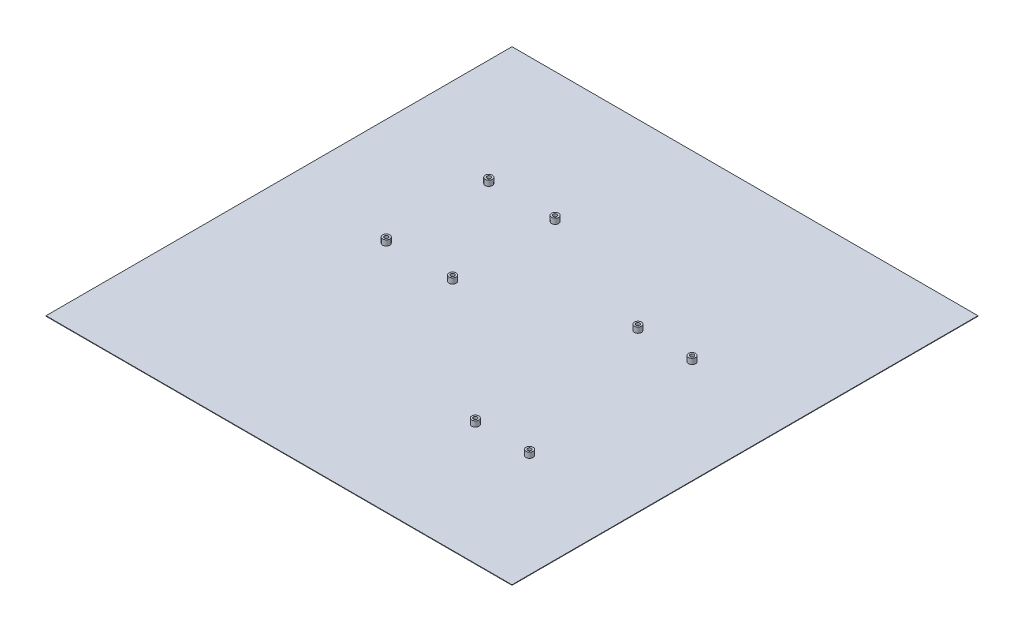
from build123d import *

# Parameters (mm, degrees)
SKETCH1_W           = 430
SKETCH1_H           = 430
BOSS_EXTRUDE1_DEPTH = 0.45
SKETCH7_R           = 3.3
BOSS_EXTRUDE2_DEPTH = 5
SKETCH8_R           = 1.75
CUT_EXTRUDE1_DEPTH  = 4
SKETCH6_R           = 3.3
BOSS_EXTRUDE3_DEPTH = 5
SKETCH10_R          = 1.75
CUT_EXTRUDE2_DEPTH  = 4


with BuildPart() as part:
    # Sketch1 → Boss-Extrude1 (new body)
    with BuildSketch(Plane(origin=(0, 0, 0), x_dir=(1, 0, 0), z_dir=(0, 1, 0))):
        Rectangle(SKETCH1_W, SKETCH1_H)
    extrude(amount=BOSS_EXTRUDE1_DEPTH)

    # Sketch7 → Boss-Extrude2 (add)
    with BuildSketch(Plane(origin=(0, 0.45, 0), x_dir=(1, 0, 0), z_dir=(0, 1, 0))):
        with Locations(Location((-116.362714529, 94.945868521, 0), (0, 0, 90))):
            Circle(SKETCH7_R)
        with Locations(Location((-55.363204635, 95.191638193, 0), (0, 0, 90))):
            Circle(SKETCH7_R)
        with Locations(Location((-54.980448566, 0.192396061, 0), (0, 0, 90))):
            Circle(SKETCH7_R)
        with Locations(Location((-115.97995846, -0.053373612, 0), (0, 0, 90))):
            Circle(SKETCH7_R)
    extrude(amount=BOSS_EXTRUDE2_DEPTH)

    # Sketch8 → Cut-Extrude1 (cut)
    with BuildSketch(Plane(origin=(0, 5.45, 0), x_dir=(1, 0, 0), z_dir=(0, 1, 0))):
        with Locations(Location((-54.980448566, 0.192396061, 0), (0, 0, 270))):
            Circle(SKETCH8_R)
        with Locations(Location((-55.363204635, 95.191638193, 0), (0, 0, 270))):
            Circle(SKETCH8_R)
        with Locations(Location((-116.362714529, 94.945868521, 0), (0, 0, 270))):
            Circle(SKETCH8_R)
        with Locations(Location((-115.97995846, -0.053373612, 0), (0, 0, 270))):
            Circle(SKETCH8_R)
    extrude(amount=-CUT_EXTRUDE1_DEPTH, mode=Mode.SUBTRACT)

    # Sketch6 → Boss-Extrude3 (add)
    with BuildSketch(Plane(origin=(0, 0.45, 0), x_dir=(1, 0, 0), z_dir=(0, 1, 0))):
        with Locations(Location((119.793345796, 46.373061352, 0), (0, 0, 90))):
            Circle(SKETCH6_R)
        with Locations(Location((69.793345796, 46.373061352, 0), (0, 0, 90))):
            Circle(SKETCH6_R)
        with Locations(Location((119.793345796, -103.626938648, 0), (0, 0, 90))):
            Circle(SKETCH6_R)
        with Locations(Location((69.793345796, -103.626938648, 0), (0, 0, 90))):
            Circle(SKETCH6_R)
    extrude(amount=BOSS_EXTRUDE3_DEPTH)

    # Sketch10 → Cut-Extrude2 (cut)
    with BuildSketch(Plane(origin=(0, 5.45, 0), x_dir=(1, 0, 0), z_dir=(0, 1, 0))):
        with Locations(Location((69.793345796, 46.373061352, 0), (0, 0, 270))):
            Circle(SKETCH10_R)
        with Locations(Location((119.793345796, 46.373061352, 0), (0, 0, 270))):
            Circle(SKETCH10_R)
        with Locations(Location((119.793345796, -103.626938648, 0), (0, 0, 270))):
            Circle(SKETCH10_R)
        with Locations(Location((69.793345796, -103.626938648, 0), (0, 0, 270))):
            Circle(SKETCH10_R)
    extrude(amount=-CUT_EXTRUDE2_DEPTH, mode=Mode.SUBTRACT)


solid = part.part
